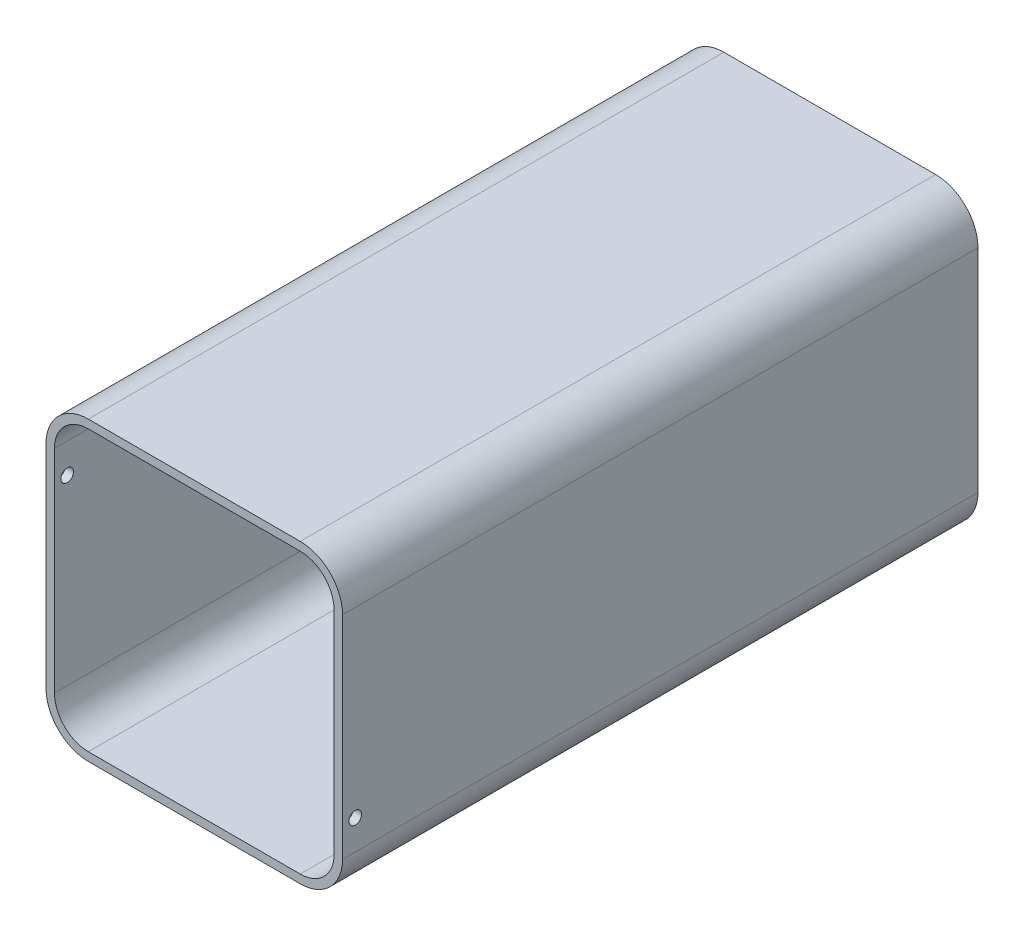
from build123d import *

# Parameters (mm, degrees)
EXTRUDE_1_DEPTH     = 150
SHELL_1_T           = -2
SKETCH_2_R          = 1.7
SKETCH_2_W          = 21
SKETCH_2_H          = 42.435234345
CUT_EXTRUDE_1_DEPTH = 150
SKETCH_3_W          = 11.907125669
SKETCH_3_H          = 29.749118518
CUT_EXTRUDE_2_DEPTH = 10
FILLET_1_R          = 2
FILLET_2_R          = 2
FILLET_3_R          = 2
FILLET_4_R          = 2
SKETCH_4_R          = 1.5
CUT_EXTRUDE_3_DEPTH = 7
SKETCH_5_R          = 1.5
CUT_EXTRUDE_4_DEPTH = 7


with BuildPart() as part:
    # 草图1 → 凸台-拉伸1 (new body)
    with BuildSketch(Plane.XY):
        with BuildLine():
            Line((-28.318229719, 20.413532085), (-28.318229719, -29.586467915))
            ThreePointArc((-28.318229719, -29.586467915), (-25.38929753, -36.657535727), (-18.318229719, -39.586467915))
            Line((-18.318229719, -39.586467915), (31.681770281, -39.586467915))
            ThreePointArc((31.681770281, -39.586467915), (38.752838093, -36.657535727), (41.681770281, -29.586467915))
            Line((41.681770281, -29.586467915), (41.681770281, 20.413532085))
            ThreePointArc((41.681770281, 20.413532085), (38.752838093, 27.484599896), (31.681770281, 30.413532085))
            Line((31.681770281, 30.413532085), (-18.318229719, 30.413532085))
            ThreePointArc((-18.318229719, 30.413532085), (-25.38929753, 27.484599896), (-28.318229719, 20.413532085))
        make_face()
    extrude(amount=EXTRUDE_1_DEPTH)

    # 抽壳1
    shell_1_openings = [part.faces().sort_by_distance(p)[0] for p in [
        (6.681770281, -4.586467915, 150),
    ]]
    offset(amount=SHELL_1_T, openings=shell_1_openings, kind=Kind.INTERSECTION)

    # 草图2 → 切除-拉伸1 (cut)
    with BuildSketch(Plane(origin=(0, 0, 0), x_dir=(-1, 0, 0), z_dir=(0, 0, -1))):
        with Locations((16.070445421, 20.123532085)):
            Circle(SKETCH_2_R)
        with Locations(Location((6.070445421, 20.123532085, 0), (0, 0, 180))):
            Circle(SKETCH_2_R)
        with Locations(Location((16.070445421, -29.296467915, 0), (0, 0, 180))):
            Circle(SKETCH_2_R)
        with Locations((6.070445421, -29.296467915)):
            Circle(SKETCH_2_R)
        with Locations((11.070445421, -4.586467916)):
            Rectangle(SKETCH_2_W, SKETCH_2_H)
    extrude(amount=-CUT_EXTRUDE_1_DEPTH, mode=Mode.SUBTRACT)

    # 草图3 → 切除-拉伸2 (cut)
    with BuildSketch(Plane(origin=(0, 0, 0), x_dir=(-1, 0, 0), z_dir=(0, 0, -1))):
        with Locations((-21.578307669, -5.268329048)):
            Rectangle(SKETCH_3_W, SKETCH_3_H)
    extrude(amount=-CUT_EXTRUDE_2_DEPTH, mode=Mode.SUBTRACT)

    # 圆角1
    fillet_1_edges = [part.edges().sort_by_distance(p)[0] for p in [
        (15.624744835, 9.606230211, 1),
    ]]
    fillet(fillet_1_edges, radius=FILLET_1_R)

    # 圆角2
    fillet_2_edges = [part.edges().sort_by_distance(p)[0] for p in [
        (15.624744835, -20.142888307, 1),
    ]]
    fillet(fillet_2_edges, radius=FILLET_2_R)

    # 圆角3
    fillet_3_edges = [part.edges().sort_by_distance(p)[0] for p in [
        (27.531870504, -20.142888307, 1),
    ]]
    fillet(fillet_3_edges, radius=FILLET_3_R)

    # 圆角4
    fillet_4_edges = [part.edges().sort_by_distance(p)[0] for p in [
        (27.531870504, 9.606230211, 1),
    ]]
    fillet(fillet_4_edges, radius=FILLET_4_R)

    # 草图4 → 切除-拉伸3 (cut)
    with BuildSketch(Plane.ZY.offset(-39.681770281)):
        with Locations((147, -22.586467915)):
            Circle(SKETCH_4_R)
    extrude(amount=-CUT_EXTRUDE_3_DEPTH, mode=Mode.SUBTRACT)

    # 草图5 → 切除-拉伸4 (cut)
    with BuildSketch(Plane(origin=(-26.318229719, 0, 0), x_dir=(0, 0, -1), z_dir=(1, 0, 0))):
        with Locations((-147, 13.413532085)):
            Circle(SKETCH_5_R)
    extrude(amount=-CUT_EXTRUDE_4_DEPTH, mode=Mode.SUBTRACT)


solid = part.part
